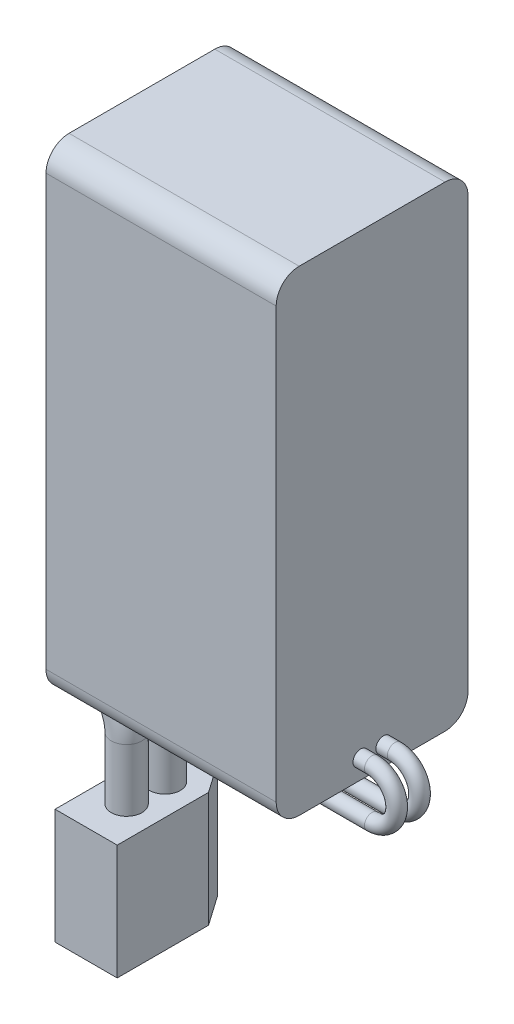
from build123d import *

# Parameters (mm, degrees)
SKETCH1_W           = 62
SKETCH1_H           = 30
BOSS_EXTRUDE1_DEPTH = 25
FILLET1_R           = 3
SKETCH2_R           = 2
SKETCH5_R           = 1
SKETCH7_W           = 3
SKETCH7_H           = 6
BOSS_EXTRUDE2_DEPTH = 3.5
BOSS_EXTRUDE2_TAPER = 3
BOSS_EXTRUDE3_DEPTH = 15


with BuildPart() as part:
    # Sketch1 → Boss-Extrude1 (new body)
    with BuildSketch(Plane(origin=(0, 0, 0), x_dir=(0, 1, 0), z_dir=(0, 0, 1))):
        Rectangle(SKETCH1_W, SKETCH1_H)
    extrude(amount=BOSS_EXTRUDE1_DEPTH)

    # Fillet1
    fillet1_edges = [part.edges().sort_by_distance(p)[0] for p in [
        (0, -31, 25),
        (0, 31, 25),
        (0, -31, 0),
        (0, 31, 0),
    ]]
    fillet(fillet1_edges, radius=FILLET1_R)

    # Sweep2: sweep along a path in Sketch4
    with BuildLine(Plane(origin=(0, 0, 0), x_dir=(0, 1, 0), z_dir=(0, 0, 1))) as sweep2_path:
        Line((-28, 15), (-28, 17.641817009))
        ThreePointArc((-28, 17.641817009), (-30.558167955, 20.670575721), (-33.97216907, 18.655085952))
        ThreePointArc((-33.97216907, 18.655085952), (-36.239159807, 15.640572518), (-39.83271041, 14.494739937))
        Line((-39.83271041, 14.494739937), (-47.929878258, 14.494739937))
    # Sketch2 → Sweep2 (sweep)
    with BuildSketch(Plane(origin=(-15, 0, 10), x_dir=(0, 0, -1), z_dir=(1, 0, 0))):
        with Locations((0, -28)):
            Circle(SKETCH2_R)
        with Locations((-5, -28)):
            Circle(SKETCH2_R)
    sweep(path=sweep2_path.line)

    # Sweep3: sweep along a path in Sketch6
    with BuildLine(Plane(origin=(0, 0, 0), x_dir=(0, 1, 0), z_dir=(0, 0, 1))) as sweep3_path:
        Line((-28.5, -15), (-28.5, -16.497724548))
        ThreePointArc((-28.5, -16.497724548), (-31.700025095, -19.697749643), (-34.900050191, -16.497724548))
        Line((-34.900050191, -16.497724548), (-34.900050191, 6.423160741))
    # Sketch5 → Sweep3 (sweep)
    with BuildSketch(Plane.YZ.offset(15)):
        with Locations((-28.5, 13.991576598)):
            Circle(SKETCH5_R)
        with Locations((-28.5, 11.008423402)):
            Circle(SKETCH5_R)
    sweep(path=sweep3_path.line)

    # Sketch7 → Boss-Extrude2 (add)
    with BuildSketch(Plane(origin=(-6.423160741, 0, 0), x_dir=(0, -1, 0), z_dir=(-1, 0, 0))):
        with Locations((34.900050191, 12.5)):
            Rectangle(SKETCH7_W, SKETCH7_H)
    extrude(amount=BOSS_EXTRUDE2_DEPTH, taper=BOSS_EXTRUDE2_TAPER)

    # Sketch8 → Boss-Extrude3 (add)
    with BuildSketch(Plane.XZ.offset(47.929878258)):
        Polygon((-18.544739937, 8.369128369), (-15.888771627, 4.576012521), (-13.100708247, 4.576012521), (-10.444739937, 8.369128369), (-10.444739937, 20.276012521), (-18.544739937, 20.276012521), align=None)
    extrude(amount=BOSS_EXTRUDE3_DEPTH)


solid = part.part
